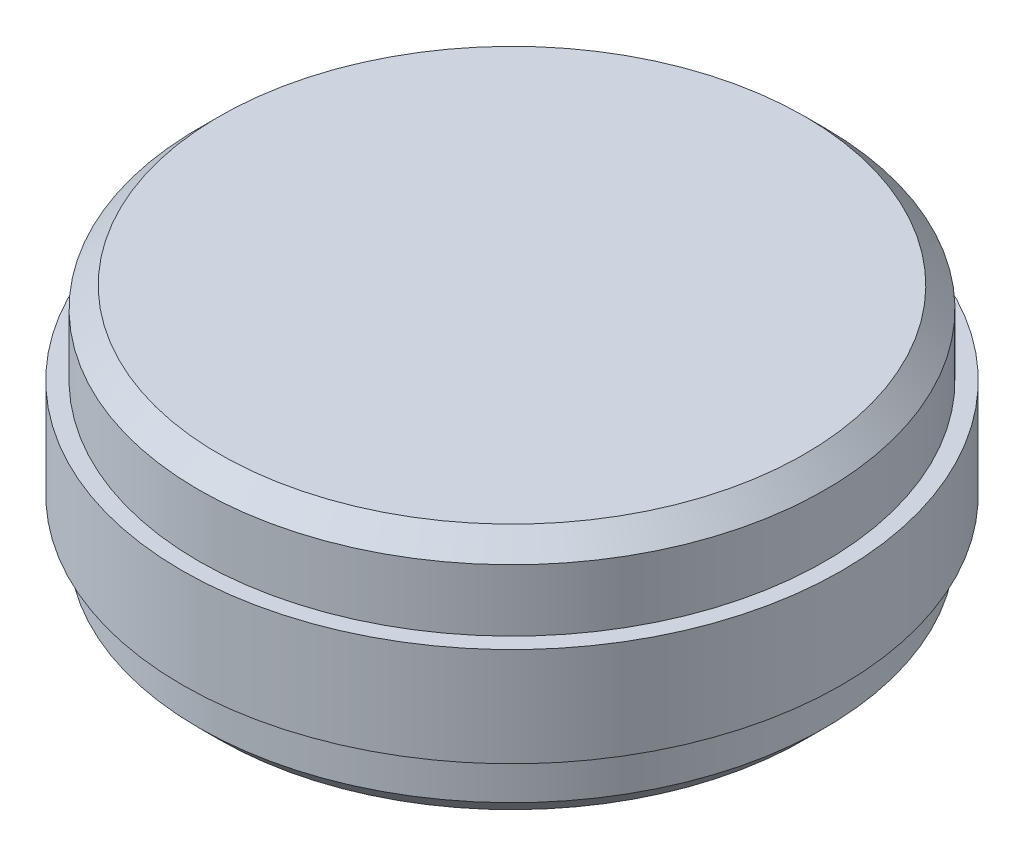
from build123d import *

# Parameters (mm, degrees)
LOX_INSTALL_SIZE    = 1.5875
O_RING_INSTALL_SIZE = 1.5875


with BuildPart() as part:
    # Sketch1 → Revolve1 (revolve)
    with BuildSketch(Plane.XY, mode=Mode.PRIVATE) as revolve1_sk:
        Polygon((0, 0), (24.13, 0), (24.13, -6.35), (25.4, -6.35), (25.4, -13.97), (24.13, -13.97), (24.13, -19.05), (0, -19.05), align=None)
    revolve(revolve1_sk.sketch.rotate(Axis((0, 0, 0), (0, -1, 0)), 90), axis=Axis((0, 0, 0), (0, -1, 0)))

    # lox install
    lox_install_edges = [part.edges().sort_by_distance(p)[0] for p in [
        (0, 0, -24.13),
    ]]
    chamfer(lox_install_edges, length=LOX_INSTALL_SIZE)

    # o-ring install
    o_ring_install_edges = [part.edges().sort_by_distance(p)[0] for p in [
        (0, -19.05, -24.13),
    ]]
    chamfer(o_ring_install_edges, length=O_RING_INSTALL_SIZE)


solid = part.part
